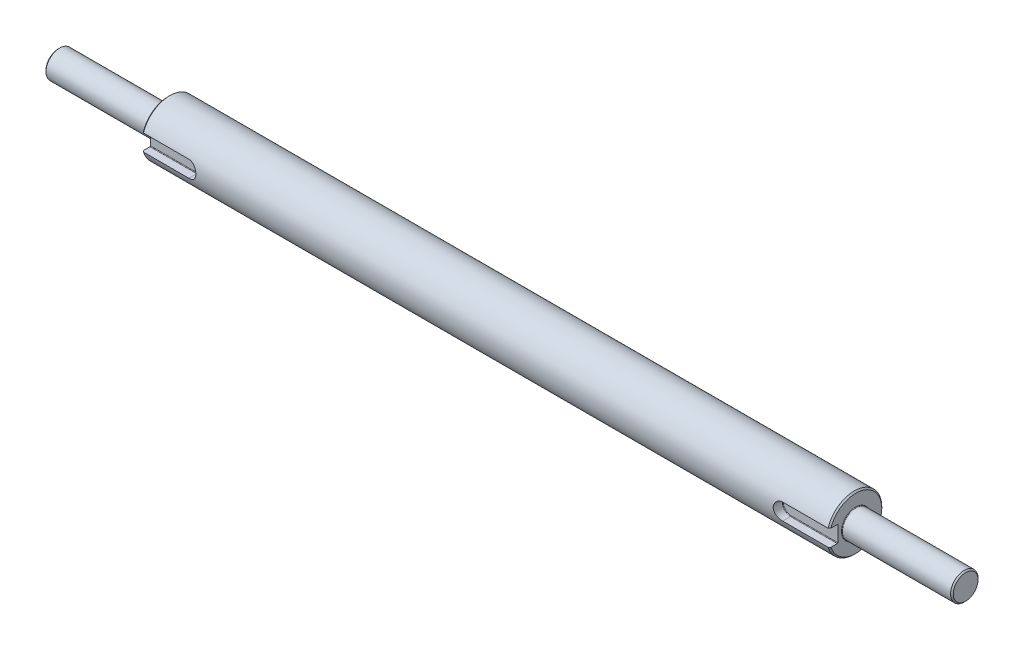
from build123d import *

# Parameters (mm, degrees)
CHAMFER1_SIZE       = 0.5
CHAMFER2_SIZE       = 0.5
CHAMFER3_SIZE       = 0.5
CHAMFER4_SIZE       = 0.5
FILLET1_R           = 0.2
FILLET2_R           = 0.2
SKETCH4_W           = 23
SKETCH4_H           = 6
BOSS_EXTRUDE3_DEPTH = 3.5
SKETCH5_W           = 23
SKETCH5_H           = 6
BOSS_EXTRUDE4_DEPTH = 3.5
FILLET6_RADIUS      = 3
FILLET6_LENGTH      = 3.5
FILLET7_RADIUS      = 3
FILLET7_LENGTH      = 3.5
FILLET8_R           = 0.2
FILLET9_RADIUS      = 3
FILLET9_LENGTH      = 3.5
FILLET10_RADIUS     = 3
FILLET10_LENGTH     = 3.5
FILLET11_R          = 0.2


with BuildPart() as part:
    # Sketch1 → Revolve1 (revolve)
    with BuildSketch(Plane.XY, mode=Mode.PRIVATE) as revolve1_sk:
        Polygon((0, 0), (330, 0), (330, 5), (290, 5), (290, 10), (40, 10), (40, 5), (0, 5), align=None)
    revolve(revolve1_sk.sketch.rotate(Axis((0, 0, 0), (1, 0, 0)), 90), axis=Axis((0, 0, 0), (1, 0, 0)))

    # Chamfer1
    chamfer1_edges = [part.edges().sort_by_distance(p)[0] for p in [
        (290, 0, -10),
    ]]
    chamfer(chamfer1_edges, length=CHAMFER1_SIZE)

    # Chamfer2
    chamfer2_edges = [part.edges().sort_by_distance(p)[0] for p in [
        (40, 0, -10),
    ]]
    chamfer(chamfer2_edges, length=CHAMFER2_SIZE)

    # Chamfer3
    chamfer3_edges = [part.edges().sort_by_distance(p)[0] for p in [
        (0, 0, -5),
    ]]
    chamfer(chamfer3_edges, length=CHAMFER3_SIZE)

    # Chamfer4
    chamfer4_edges = [part.edges().sort_by_distance(p)[0] for p in [
        (330, 0, -5),
    ]]
    chamfer(chamfer4_edges, length=CHAMFER4_SIZE)

    # Fillet1
    fillet1_edges = [part.edges().sort_by_distance(p)[0] for p in [
        (40, 0, -5),
    ]]
    fillet(fillet1_edges, radius=FILLET1_R)

    # Fillet2
    fillet2_edges = [part.edges().sort_by_distance(p)[0] for p in [
        (290, 0, -5),
    ]]
    fillet(fillet2_edges, radius=FILLET2_R)


with BuildPart() as body_2:
    # Sketch4 → Boss-Extrude3 (new body)
    with BuildSketch(Plane.XY.offset(10)):
        with Locations((48.5, 0)):
            Rectangle(SKETCH4_W, SKETCH4_H)
    extrude(amount=-BOSS_EXTRUDE3_DEPTH)

    # Fillet6: full round fillet: the end face becomes a half cylinder, R = half its width
    fillet6_face = Plane((37, 0, 8.25), x_dir=(0, 0, 1), z_dir=(-1, 0, 0))  # on the end face: x along it, z out of the body
    fillet6_slab = fillet6_face.offset(-FILLET6_RADIUS / 2) * Box(FILLET6_LENGTH, 2 * FILLET6_RADIUS, FILLET6_RADIUS, mode=Mode.PRIVATE)  # the body's end, R deep
    fillet6_round = Plane((40, 0, 8.25), x_dir=(-1, 0, 0), z_dir=(0, 0, 1)) * Cylinder(FILLET6_RADIUS, FILLET6_LENGTH, mode=Mode.PRIVATE)  # its axis R under the face
    add(fillet6_slab - fillet6_round, mode=Mode.SUBTRACT)

    # Fillet7: full round fillet: the end face becomes a half cylinder, R = half its width
    fillet7_face = Plane((60, 0, 8.25), x_dir=(0, 0, -1), z_dir=(1, 0, 0))  # on the end face: x along it, z out of the body
    fillet7_slab = fillet7_face.offset(-FILLET7_RADIUS / 2) * Box(FILLET7_LENGTH, 2 * FILLET7_RADIUS, FILLET7_RADIUS, mode=Mode.PRIVATE)  # the body's end, R deep
    fillet7_round = Plane((57, 0, 8.25), x_dir=(1, 0, 0), z_dir=(0, 0, -1)) * Cylinder(FILLET7_RADIUS, FILLET7_LENGTH, mode=Mode.PRIVATE)  # its axis R under the face
    add(fillet7_slab - fillet7_round, mode=Mode.SUBTRACT)

    # Fillet8
    fillet8_edges = [body_2.edges().sort_by_distance(p)[0] for p in [
        (48.5, -3, 6.5),
        (37, 0, 6.5),
        (48.5, 3, 6.5),
        (60, 0, 6.5),
    ]]
    fillet(fillet8_edges, radius=FILLET8_R)


with BuildPart() as body_3:
    # Sketch5 → Boss-Extrude4 (new body)
    with BuildSketch(Plane.XY.offset(10)):
        with Locations((281.5, 0)):
            Rectangle(SKETCH5_W, SKETCH5_H)
    extrude(amount=-BOSS_EXTRUDE4_DEPTH)

    # Fillet9: full round fillet: the end face becomes a half cylinder, R = half its width
    fillet9_face = Plane((293, 0, 8.25), x_dir=(0, 0, 1), z_dir=(1, 0, 0))  # on the end face: x along it, z out of the body
    fillet9_slab = fillet9_face.offset(-FILLET9_RADIUS / 2) * Box(FILLET9_LENGTH, 2 * FILLET9_RADIUS, FILLET9_RADIUS, mode=Mode.PRIVATE)  # the body's end, R deep
    fillet9_round = Plane((290, 0, 8.25), x_dir=(1, 0, 0), z_dir=(0, 0, 1)) * Cylinder(FILLET9_RADIUS, FILLET9_LENGTH, mode=Mode.PRIVATE)  # its axis R under the face
    add(fillet9_slab - fillet9_round, mode=Mode.SUBTRACT)

    # Fillet10: full round fillet: the end face becomes a half cylinder, R = half its width
    fillet10_face = Plane((270, 0, 8.25), x_dir=(0, 0, 1), z_dir=(-1, 0, 0))  # on the end face: x along it, z out of the body
    fillet10_slab = fillet10_face.offset(-FILLET10_RADIUS / 2) * Box(FILLET10_LENGTH, 2 * FILLET10_RADIUS, FILLET10_RADIUS, mode=Mode.PRIVATE)  # the body's end, R deep
    fillet10_round = Plane((273, 0, 8.25), x_dir=(-1, 0, 0), z_dir=(0, 0, 1)) * Cylinder(FILLET10_RADIUS, FILLET10_LENGTH, mode=Mode.PRIVATE)  # its axis R under the face
    add(fillet10_slab - fillet10_round, mode=Mode.SUBTRACT)

    # Fillet11
    fillet11_edges = [body_3.edges().sort_by_distance(p)[0] for p in [
        (281.5, 3, 6.5),
        (293, 0, 6.5),
        (281.5, -3, 6.5),
        (270, 0, 6.5),
    ]]
    fillet(fillet11_edges, radius=FILLET11_R)


with BuildPart() as part_1:
    add(part.part)

    # Combine2: cut body 2, body 3
    add(body_2.part, mode=Mode.SUBTRACT)
    add(body_3.part, mode=Mode.SUBTRACT)


solid = part_1.part
